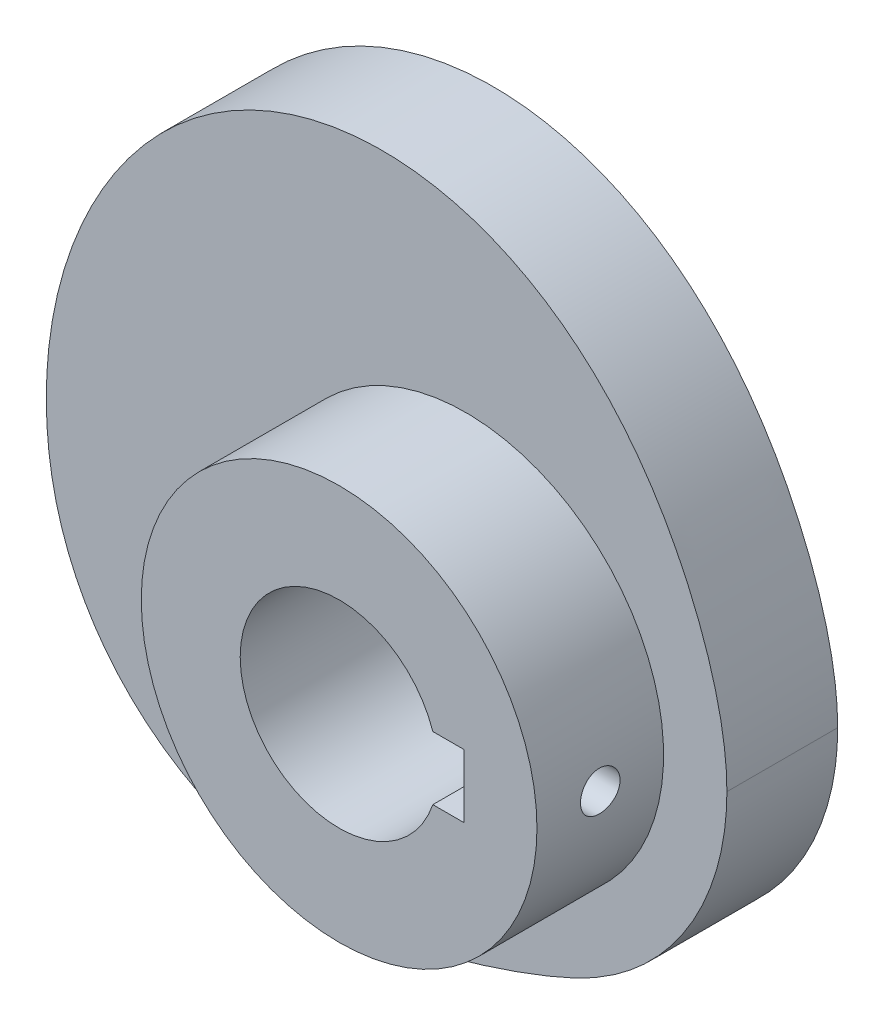
from build123d import *

# Parameters (mm, degrees)
EXTRUDE_1_DEPTH     = 14
SKETCH_2_R          = 25
EXTRUDE_2_DEPTH     = 30
SKETCH_3_R          = 12.5
CUT_EXTRUDE_1_DEPTH = 78.786850529
SKETCH_4_W          = 15.8
SKETCH_4_H          = 8
CUT_EXTRUDE_2_DEPTH = 78.786850529
SWEEP_2_PROFILE_R   = 2.5


with BuildPart() as part:
    # 草图1 → 凸台-拉伸1 (new body)
    with BuildSketch(Plane.XY):
        with BuildLine():
            add(Edge.make_bspline(
                [(33, 0), (32.994684587, 0.450024215), (32.984052078, 1.350215217), (32.901076258, 2.698653645), (32.772860205, 4.043927251), (32.597324571, 5.384974816), (32.378634546, 6.721198171), (32.032078752, 8.498284254), (31.501703341, 10.710471336), (30.726699331, 13.347427223), (29.820422985, 15.978337375), (28.78376894, 18.611676644), (27.610273888, 21.254339279), (26.515182854, 23.45103287), (25.5574803, 25.211343802), (24.789016632, 26.54270045), (23.972675772, 27.874149931), (23.105472148, 29.203671357), (22.184421782, 30.528688408), (21.206602984, 31.846069432), (20.16924743, 33.152137052), (19.069811985, 34.442677822), (17.90606236, 35.712977232), (16.676140858, 36.957852112), (15.37863945, 38.17170453), (14.012657383, 39.348574759), (12.57785829, 40.48221221), (11.07450942, 41.566141858), (9.503524234, 42.593753741), (7.866477955, 43.558375054), (6.165627296, 44.453366408), (4.403908588, 45.272204934), (2.584926869, 46.008571066), (0.712936618, 46.656438122), (-1.207193797, 47.210150802), (-3.170021946, 47.66451179), (-5.169590122, 48.014834863), (-7.19948183, 48.257032362), (-9.252895705, 48.387650153), (-11.322721226, 48.403921527), (-13.401619953, 48.303802916), (-15.482112157, 48.085992666), (-17.556663385, 47.74994839), (-19.617771107, 47.295872816), (-21.658056561, 46.724726957), (-23.670342116, 46.038176688), (-25.647738102, 45.238585056), (-27.583709079, 44.328944976), (-29.472149374, 43.312844419), (-31.307433374, 42.194386964), (-33.084472119, 40.978136682), (-34.798745182, 39.669031546), (-36.446339426, 38.272314352), (-38.023943914, 36.793434836), (-39.528922958, 35.238009279), (-40.959078807, 33.611599403), (-42.313460643, 31.920114124), (-43.589311507, 30.167983471), (-44.793272704, 28.364572965), (-45.530637058, 27.121554401), (-45.899346, 26.5)],
                knots=[0, 0, 0, 0, 0.011720528, 0.02344477, 0.035174471, 0.046912746, 0.058664172, 0.070434849, 0.094064277, 0.117883715, 0.141995125, 0.166516265, 0.191571891, 0.217283663, 0.230421312, 0.243762401, 0.257317187, 0.271094269, 0.285100438, 0.299340704, 0.313818209, 0.328534322, 0.343488665, 0.358679258, 0.374102619, 0.38975391, 0.405627105, 0.421715168, 0.438010208, 0.454503662, 0.471186473, 0.488049229, 0.505082314, 0.522276079, 0.539620899, 0.557107331, 0.574726161, 0.592468467, 0.610325686, 0.6282896, 0.646352393, 0.664506599, 0.682745118, 0.701061152, 0.719448204, 0.737900044, 0.756410636, 0.774974145, 0.7935849, 0.812237383, 0.830926227, 0.84964623, 0.86839239, 0.887159977, 0.90594454, 0.924742047, 0.943548942, 0.962362269, 0.981179768, 1, 1, 1, 1], degree=3))
            add(Edge.make_bspline(
                [(-45.899346, 26.5), (-46.183686014, 25.99658476), (-46.752365912, 24.989754507), (-47.542151603, 23.44514535), (-48.284558357, 21.877468697), (-48.974312895, 20.285818041), (-49.611879734, 18.672591924), (-50.196252541, 17.039331265), (-50.726892215, 15.387834686), (-51.203206677, 13.719857757), (-51.62469458, 12.037190136), (-51.990895237, 10.341632673), (-52.301444487, 8.635001114), (-52.555908827, 6.919122788), (-52.754388224, 5.195835615), (-52.895284113, 3.466984365), (-52.98361346, 1.734420848), (-52.994537821, 0.578140181), (-53, 0)],
                knots=[0, 0, 0, 0, 0.062500008, 0.124999987, 0.187499996, 0.249999999, 0.312499987, 0.374999994, 0.437500002, 0.500000019, 0.562500001, 0.625000006, 0.687500007, 0.75000001, 0.812500019, 0.874999996, 0.937500015, 1, 1, 1, 1], degree=3))
            add(Edge.make_bspline(
                [(-53, 0), (-52.994536306, -0.578068365), (-52.983610487, -1.734039205), (-52.890921769, -3.465687653), (-52.737459804, -5.192153917), (-52.514830205, -6.910368406), (-52.221750153, -8.616869483), (-51.855756316, -10.30788244), (-51.415431279, -11.979386603), (-50.899814435, -13.627185589), (-50.308555585, -15.246972675), (-49.641851525, -16.834390924), (-48.90046009, -18.385099751), (-48.085659908, -19.894826006), (-47.199233749, -21.359419817), (-46.243441559, -22.77490659), (-45.220979977, -24.137526422), (-44.134954865, -25.443781463), (-42.988839739, -26.690470176), (-41.786431369, -27.874717783), (-40.531812023, -28.994003994), (-39.22930277, -30.046187837), (-37.883420895, -31.029524247), (-36.498828408, -31.94267376), (-35.08029367, -32.784716601), (-33.632637068, -33.55514713), (-32.160696249, -34.253885921), (-30.669272011, -34.881258756), (-29.163092884, -35.437998224), (-27.646770009, -35.925222878), (-26.124761473, -36.344421792), (-24.601335518, -36.69743659), (-23.080535449, -36.986424819), (-21.566151621, -37.21384479), (-20.06169318, -37.382416012), (-18.570364754, -37.495089115), (-17.09504745, -37.555010185), (-15.63828303, -37.565478254), (-14.202260945, -37.529911258), (-12.788815604, -37.451808758), (-11.399408098, -37.334697574), (-9.594924838, -37.132882108), (-7.403548822, -36.80259903), (-4.857653491, -36.301470095), (-2.413691345, -35.722805964), (-0.064581352, -35.086952206), (2.19985327, -34.409599534), (4.391499881, -33.700962662), (6.522577444, -32.965335838), (8.60383086, -32.200414937), (10.643647529, -31.398673827), (12.643577343, -30.542836156), (14.606977568, -29.624742426), (15.869373093, -28.927262542), (16.5, -28.578838)],
                knots=[0, 0, 0, 0, 0.018617485, 0.037229627, 0.055835032, 0.074431523, 0.093016392, 0.111586604, 0.130138962, 0.148670157, 0.167176824, 0.185655535, 0.204102805, 0.22251502, 0.240888411, 0.259219008, 0.277502562, 0.295734481, 0.313909833, 0.332023234, 0.350068877, 0.368040428, 0.385931136, 0.403733696, 0.421440373, 0.439042968, 0.456532892, 0.473901167, 0.491138559, 0.508235601, 0.525182699, 0.541970207, 0.558588573, 0.575028394, 0.591280583, 0.607336484, 0.623187988, 0.638827665, 0.654248924, 0.669446162, 0.68441483, 0.699151658, 0.727921526, 0.755761391, 0.782700659, 0.808796619, 0.834133633, 0.858819493, 0.882978406, 0.906741052, 0.93023242, 0.953559502, 0.976800752, 1, 1, 1, 1], degree=3))
            add(Edge.make_bspline(
                [(16.5, -28.578838), (17.116689929, -28.207079649), (18.350069625, -27.463563045), (20.10262845, -26.197892511), (21.774178875, -24.828826667), (23.35112871, -23.351084244), (24.828450291, -21.773980361), (26.19935355, -20.10346697), (27.458095264, -18.346914058), (28.599248007, -16.511783882), (29.617940435, -14.605950878), (30.509791163, -12.637572777), (31.27104422, -10.615077714), (31.898195971, -8.547128331), (32.389483458, -6.442578551), (32.739354772, -4.310440562), (32.959177295, -2.15984452), (32.986392432, -0.719948155), (33, 0)],
                knots=[0, 0, 0, 0, 0.062500006, 0.124999996, 0.187499992, 0.249999998, 0.312500003, 0.374999999, 0.437499989, 0.499999995, 0.562499988, 0.625000012, 0.687500008, 0.750000012, 0.812499988, 0.875000009, 0.937500007, 1, 1, 1, 1], degree=3))
        make_face()
    extrude(amount=EXTRUDE_1_DEPTH)

    # 草图2 → 凸台-拉伸2 (add)
    with BuildSketch(Plane.XY):
        with Locations(Location((0, 0, 0), (0, 0, 180))):
            Circle(SKETCH_2_R)
    extrude(amount=EXTRUDE_2_DEPTH)

    # 草图3 → 切除-拉伸1 (cut, through all)
    with BuildSketch(Plane.XY):
        Circle(SKETCH_3_R)
    extrude(amount=CUT_EXTRUDE_1_DEPTH, mode=Mode.SUBTRACT)

    # 草图4 → 切除-拉伸2 (cut, through all)
    with BuildSketch(Plane.XY):
        with Locations((7.9, 0)):
            Rectangle(SKETCH_4_W, SKETCH_4_H)
    extrude(amount=CUT_EXTRUDE_2_DEPTH, mode=Mode.SUBTRACT)

    # 切除-扫描2: sweep along a curve in space
    with BuildLine() as sweep_2_path:
        Line((-1, 0, 22), (26, 0, 22))
    # 切除-扫描2 profile (on start of the path) → 切除-扫描2 (sweep, cut)
    with BuildSketch(Plane(origin=(-1, 0, 22), x_dir=(0, 0, 1), z_dir=(1, 0, 0))):
        Circle(SWEEP_2_PROFILE_R)
    sweep(path=sweep_2_path.line, mode=Mode.SUBTRACT)


solid = part.part
